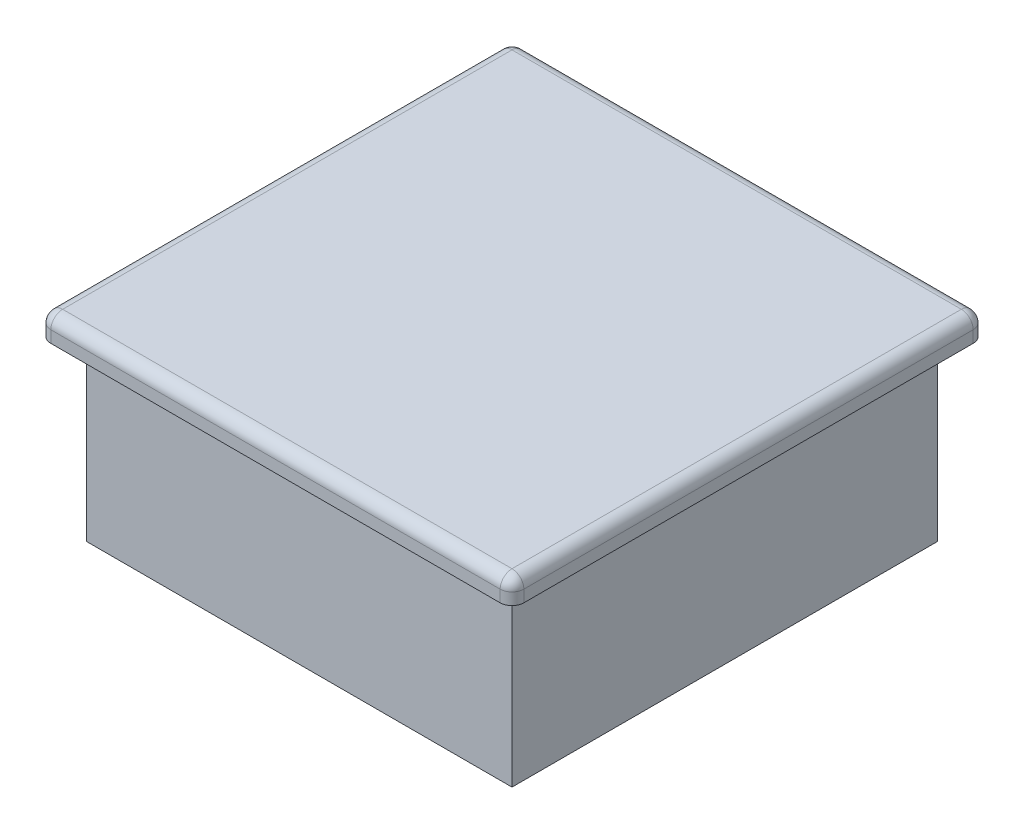
from build123d import *

# Parameters (mm, degrees)
SKETCH1_W           = 40
SKETCH1_H           = 40
BOSS_EXTRUDE1_DEPTH = 2
SKETCH2_W           = 36
SKETCH2_H           = 36
SKETCH2_W_2         = 32
SKETCH2_H_2         = 32
BOSS_EXTRUDE2_DEPTH = 15
FILLET1_R           = 1


with BuildPart() as part:
    # Sketch1 → Boss-Extrude1 (new body)
    with BuildSketch(Plane(origin=(0, 0, 0), x_dir=(1, 0, 0), z_dir=(0, 1, 0))):
        Rectangle(SKETCH1_W, SKETCH1_H)
    extrude(amount=BOSS_EXTRUDE1_DEPTH)

    # Sketch2 → Boss-Extrude2 (add)
    with BuildSketch(Plane(origin=(0, 0, 0), x_dir=(-1, 0, 0), z_dir=(0, -1, 0))):
        Rectangle(SKETCH2_W, SKETCH2_H)
        Rectangle(SKETCH2_W_2, SKETCH2_H_2, mode=Mode.SUBTRACT)
    extrude(amount=BOSS_EXTRUDE2_DEPTH)

    # Fillet1
    fillet1_edges = [part.edges().sort_by_distance(p)[0] for p in [
        (-20, 2, 0),
        (0, 2, 20),
        (20, 2, 0),
        (0, 2, -20),
        (20, 1, 20),
        (-20, 1, 20),
        (-20, 1, -20),
        (20, 1, -20),
    ]]
    fillet(fillet1_edges, radius=FILLET1_R)


solid = part.part
